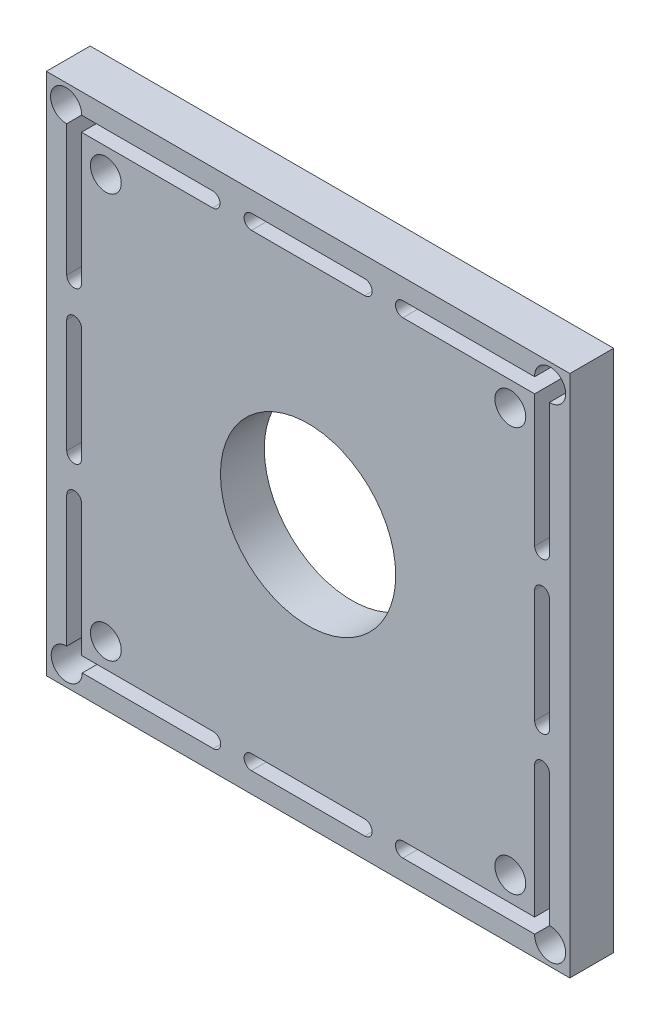
from build123d import *

# Parameters (mm, degrees)
SKETCH1_W           = 37.9349
SKETCH1_H           = 37.9349
BOSS_EXTRUDE1_DEPTH = 3.175
SKETCH9_R           = 1.1176
SKETCH9_R_2         = 6.35
CUT_EXTRUDE2_DEPTH  = 3.175


with BuildPart() as part:
    # Sketch1 → Boss-Extrude1 (new body)
    with BuildSketch(Plane.XY):
        with Locations((18.96745, 18.96745)):
            Rectangle(SKETCH1_W, SKETCH1_H)
    extrude(amount=BOSS_EXTRUDE1_DEPTH)

    # Sketch9 → Cut-Extrude2 (cut)
    with BuildSketch(Plane.XY.offset(3.175)):
        with Locations((33.62325, 33.62325)):
            Circle(SKETCH9_R)
        with Locations((4.31165, 33.62325)):
            Circle(SKETCH9_R)
        with Locations((4.31165, 4.31165)):
            Circle(SKETCH9_R)
        with Locations((33.62325, 4.31165)):
            Circle(SKETCH9_R)
        with Locations((18.96745, 18.96745)):
            Circle(SKETCH9_R_2)
        with BuildLine():
            Line((35.385619933, 12.100169933), (35.385619933, 2.549280067))
            Line((35.385619933, 2.549280067), (25.834730067, 2.549280067))
            ThreePointArc((25.834730067, 2.549280067), (25.2984, 2.01295), (25.834730067, 1.476619933))
            Line((25.834730067, 1.476619933), (35.385619933, 1.476619933))
            ThreePointArc((35.385619933, 1.476619933), (37.303202335, 0.631697665), (36.458280067, 2.549280067))
            Line((36.458280067, 2.549280067), (36.458280067, 12.100169933))
            ThreePointArc((36.458280067, 12.100169933), (35.92195, 12.6365), (35.385619933, 12.100169933))
        make_face()
        with BuildLine():
            Line((35.385619933, 36.458280067), (25.834730067, 36.458280067))
            ThreePointArc((25.834730067, 36.458280067), (25.2984, 35.92195), (25.834730067, 35.385619933))
            Line((25.834730067, 35.385619933), (35.385619933, 35.385619933))
            Line((35.385619933, 35.385619933), (35.385619933, 25.834730067))
            ThreePointArc((35.385619933, 25.834730067), (35.92195, 25.2984), (36.458280067, 25.834730067))
            Line((36.458280067, 25.834730067), (36.458280067, 35.385619933))
            ThreePointArc((36.458280067, 35.385619933), (37.303202335, 37.303202335), (35.385619933, 36.458280067))
        make_face()
        with BuildLine():
            Line((12.048880067, 36.458280067), (2.549280067, 36.458280067))
            ThreePointArc((2.549280067, 36.458280067), (0.631697665, 37.303202335), (1.476619933, 35.385619933))
            Line((1.476619933, 35.385619933), (1.476619933, 25.886019933))
            ThreePointArc((1.476619933, 25.886019933), (2.01295, 25.349689867), (2.549280067, 25.886019933))
            Line((2.549280067, 25.886019933), (2.549280067, 35.385619933))
            Line((2.549280067, 35.385619933), (12.048880067, 35.385619933))
            ThreePointArc((12.048880067, 35.385619933), (12.585210133, 35.92195), (12.048880067, 36.458280067))
        make_face()
        with BuildLine():
            Line((23.06955, 36.458280067), (14.86535, 36.458280067))
            ThreePointArc((14.86535, 36.458280067), (14.329019933, 35.92195), (14.86535, 35.385619933))
            Line((14.86535, 35.385619933), (23.06955, 35.385619933))
            ThreePointArc((23.06955, 35.385619933), (23.605880067, 35.92195), (23.06955, 36.458280067))
        make_face()
        with BuildLine():
            Line((2.549280067, 23.06955), (2.549280067, 14.86535))
            ThreePointArc((2.549280067, 14.86535), (2.01295, 14.329019933), (1.476619933, 14.86535))
            Line((1.476619933, 14.86535), (1.476619933, 23.06955))
            ThreePointArc((1.476619933, 23.06955), (2.01295, 23.605880067), (2.549280067, 23.06955))
        make_face()
        with BuildLine():
            Line((36.458280067, 23.06955), (36.458280067, 14.86535))
            ThreePointArc((36.458280067, 14.86535), (35.92195, 14.329019933), (35.385619933, 14.86535))
            Line((35.385619933, 14.86535), (35.385619933, 23.06955))
            ThreePointArc((35.385619933, 23.06955), (35.92195, 23.605880067), (36.458280067, 23.06955))
        make_face()
        with BuildLine():
            Line((23.06955, 2.549280067), (14.86535, 2.549280067))
            ThreePointArc((14.86535, 2.549280067), (14.329019933, 2.01295), (14.86535, 1.476619933))
            Line((14.86535, 1.476619933), (23.06955, 1.476619933))
            ThreePointArc((23.06955, 1.476619933), (23.605880067, 2.01295), (23.06955, 2.549280067))
        make_face()
        with BuildLine():
            Line((2.549280067, 12.100169933), (2.549280067, 2.549280067))
            Line((2.549280067, 2.549280067), (12.100169933, 2.549280067))
            ThreePointArc((12.100169933, 2.549280067), (12.6365, 2.01295), (12.100169933, 1.476619933))
            Line((12.100169933, 1.476619933), (2.600569933, 1.476619933))
            ThreePointArc((2.600569933, 1.476619933), (0.681867267, 0.681867267), (1.476619933, 2.600569933))
            Line((1.476619933, 2.600569933), (1.476619933, 12.100169933))
            ThreePointArc((1.476619933, 12.100169933), (2.01295, 12.6365), (2.549280067, 12.100169933))
        make_face()
    extrude(amount=-CUT_EXTRUDE2_DEPTH, mode=Mode.SUBTRACT)


solid = part.part
